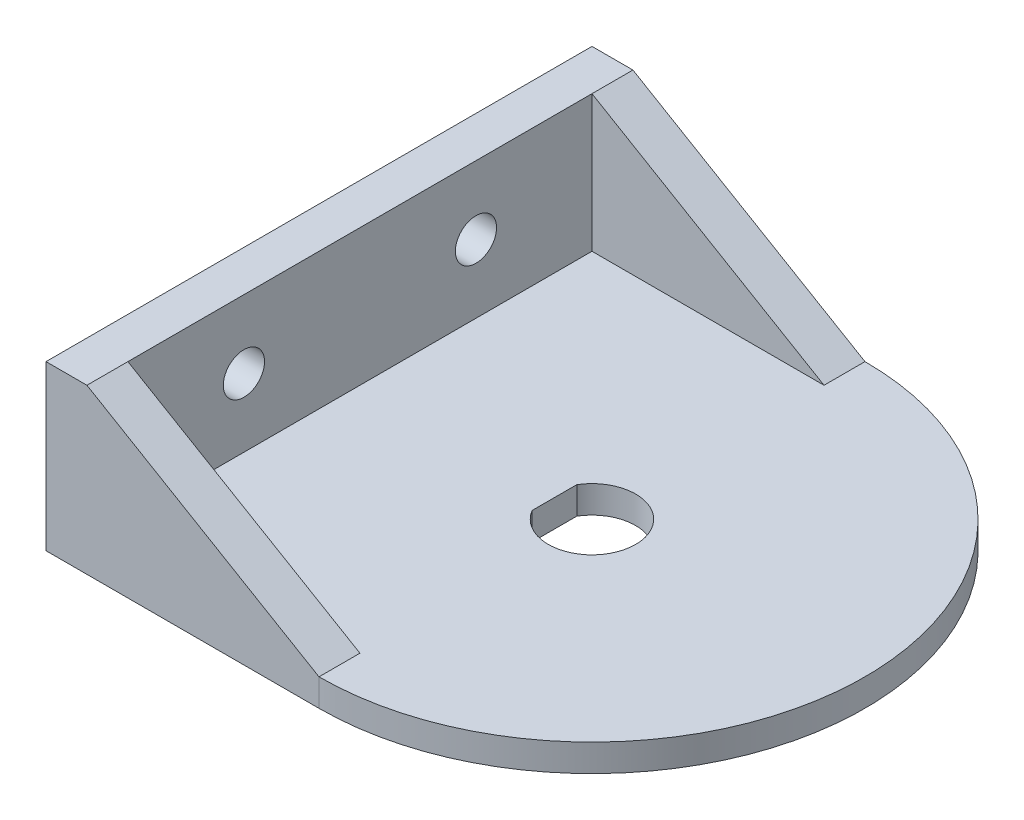
from build123d import *

# Parameters (mm, degrees)
BOSS_EXTRUDE1_DEPTH = 2
BOSS_EXTRUDE2_DEPTH = 12
BOSS_EXTRUDE3_DEPTH = 3
BOSS_EXTRUDE4_DEPTH = 3
BOSS_EXTRUDE5_START = -2
BOSS_EXTRUDE5_DEPTH = 2
CUT_EXTRUDE1_DEPTH  = 3


with BuildPart() as part:
    # Sketch1 → Boss-Extrude1 (new body)
    with BuildSketch(Plane(origin=(0, 0, 0), x_dir=(1, 0, 0), z_dir=(0, 1, 0))):
        with BuildLine():
            ThreePointArc((0, -3.2), (-3.2, 0), (0, 3.2))
            Line((0, 3.2), (0, 20))
            ThreePointArc((0, 20), (-9.728487163, 17.474453855), (-17, 10.535653753))
            Line((-17, 10.535653753), (-17, -10.535653753))
            ThreePointArc((-17, -10.535653753), (-9.728487163, -17.474453855), (0, -20))
            Line((0, -20), (0, -3.2))
        make_face()
        with BuildLine():
            Line((0, 20), (0, 3.2))
            ThreePointArc((0, 3.2), (2.2627417, 2.2627417), (3.2, 0))
            ThreePointArc((3.2, 0), (2.2627417, -2.2627417), (0, -3.2))
            Line((0, -3.2), (0, -20))
            ThreePointArc((0, -20), (14.142135624, -14.142135624), (20, 0))
            ThreePointArc((20, 0), (14.142135624, 14.142135624), (0, 20))
        make_face()
        with BuildLine():
            Line((-17, -20), (0, -20))
            ThreePointArc((0, -20), (-9.728487163, -17.474453855), (-17, -10.535653753))
            Line((-17, -10.535653753), (-17, -20))
        make_face()
        with BuildLine():
            Line((-20, -20), (-17, -20))
            Line((-17, -20), (-17, -10.535653753))
            ThreePointArc((-17, -10.535653753), (-19.235384062, -5.477225575), (-20, 0))
            Line((-20, 0), (-20, -20))
        make_face()
        with BuildLine():
            Line((-17, -10.535653753), (-17, 10.535653753))
            ThreePointArc((-17, 10.535653753), (-19.235384062, 5.477225575), (-20, 0))
            ThreePointArc((-20, 0), (-19.235384062, -5.477225575), (-17, -10.535653753))
        make_face()
        with BuildLine():
            Line((-17, 10.535653753), (-17, 20))
            Line((-17, 20), (-20, 20))
            Line((-20, 20), (-20, 0))
            ThreePointArc((-20, 0), (-19.235384062, 5.477225575), (-17, 10.535653753))
        make_face()
        with BuildLine():
            ThreePointArc((-17, 10.535653753), (-9.728487163, 17.474453855), (0, 20))
            Line((0, 20), (-17, 20))
            Line((-17, 20), (-17, 10.535653753))
        make_face()
    extrude(amount=BOSS_EXTRUDE1_DEPTH)

    # Sketch1<4> → Boss-Extrude2 (add)
    with BuildSketch(Plane(origin=(0, 0, 0), x_dir=(1, 0, 0), z_dir=(0, 1, 0))):
        with BuildLine():
            Line((-17, 10.535653753), (-17, 20))
            Line((-17, 20), (-20, 20))
            Line((-20, 20), (-20, 0))
            ThreePointArc((-20, 0), (-19.235384062, 5.477225575), (-17, 10.535653753))
        make_face()
        with BuildLine():
            Line((-17, -10.535653753), (-17, 10.535653753))
            ThreePointArc((-17, 10.535653753), (-19.235384062, 5.477225575), (-20, 0))
            ThreePointArc((-20, 0), (-19.235384062, -5.477225575), (-17, -10.535653753))
        make_face()
        with BuildLine():
            Line((-20, -20), (-17, -20))
            Line((-17, -20), (-17, -10.535653753))
            ThreePointArc((-17, -10.535653753), (-19.235384062, -5.477225575), (-20, 0))
            Line((-20, 0), (-20, -20))
        make_face()
    extrude(amount=BOSS_EXTRUDE2_DEPTH)

    # Sketch2 → Boss-Extrude3 (add)
    with BuildSketch(Plane.XY.offset(20)):
        Polygon((-17, 12), (0, 2), (-17, 2), align=None)
    extrude(amount=-BOSS_EXTRUDE3_DEPTH)

    # Sketch3 → Boss-Extrude4 (add)
    with BuildSketch(Plane(origin=(0, 0, -20), x_dir=(-1, 0, 0), z_dir=(0, 0, -1))):
        Polygon((17, 12), (0, 2), (17, 2), align=None)
    extrude(amount=-BOSS_EXTRUDE4_DEPTH)

    # Sketch4 → Boss-Extrude5 (add)
    with BuildSketch(Plane(origin=(0, 2, 0), x_dir=(1, 0, 0), z_dir=(0, 1, 0)).offset(BOSS_EXTRUDE5_START)):
        with BuildLine():
            Line((-2.75, -1.636306817), (-2.75, 0))
            Line((-2.75, 0), (-2.75, 1.636306817))
            ThreePointArc((-2.75, 1.636306817), (-3.2, 0), (-2.75, -1.636306817))
        make_face()
    extrude(amount=BOSS_EXTRUDE5_DEPTH)

    # Sketch5 → Cut-Extrude1 (cut)
    with BuildSketch(Plane(origin=(-17, 0, 0), x_dir=(0, 0, -1), z_dir=(1, 0, 0))):
        with BuildLine():
            ThreePointArc((-10.01, 7), (-8.5, 5.49), (-6.99, 7))
            Line((-6.99, 7), (-10.01, 7))
        make_face()
        with BuildLine():
            Line((-10.01, 7), (-6.99, 7))
            ThreePointArc((-6.99, 7), (-8.5, 8.51), (-10.01, 7))
        make_face()
        with BuildLine():
            ThreePointArc((10.01, 7), (8.5, 8.51), (6.99, 7))
            Line((6.99, 7), (10.01, 7))
        make_face()
        with BuildLine():
            Line((10.01, 7), (6.99, 7))
            ThreePointArc((6.99, 7), (8.5, 5.49), (10.01, 7))
        make_face()
    extrude(amount=-CUT_EXTRUDE1_DEPTH, mode=Mode.SUBTRACT)


solid = part.part
